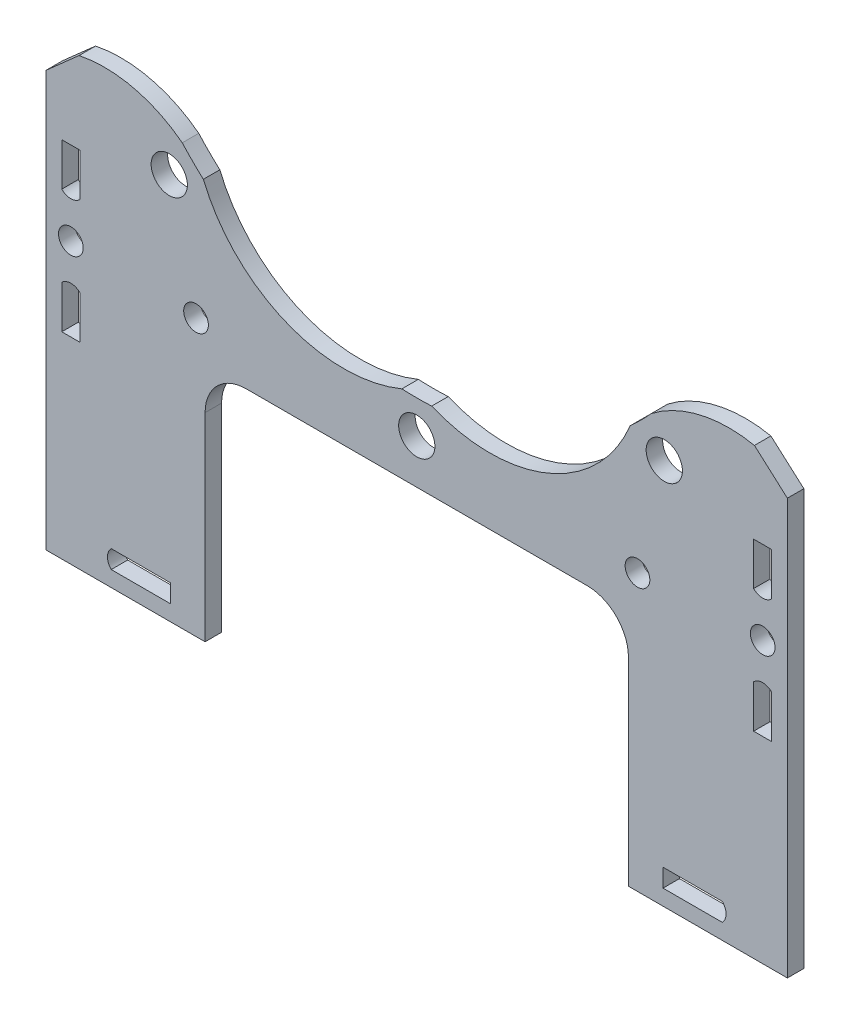
from build123d import *

# Parameters (mm, degrees)
SKETCH_3_R      = 2.2
SKETCH_3_R_2    = 1.5
EXTRUDE_1_DEPTH = 2


with BuildPart() as part:
    # 草图3 → 凸台-拉伸1 (new body)
    with BuildSketch(Plane.XY):
        with BuildLine():
            Line((-41, -23.990216685), (-42, -23.990216685))
            Line((-42, -23.990216685), (-44, -23.990216685))
            Line((-44, -23.990216685), (-45, -23.990216685))
            Line((-45, -23.990216685), (-45, 5.009783315))
            Line((-45, 5.009783315), (-45, 15.009783315))
            Line((-45, 15.009783315), (-45, 26.463053661))
            Line((-45, 26.463053661), (-41, 30.009783315))
            ThreePointArc((-41, 30.009783315), (-34.419700625, 29.918417102), (-28.474223323, 27.097072158))
            ThreePointArc((-28.474223323, 27.097072158), (-27.224142294, 25.7867036), (-25.913822519, 24.536571436))
            ThreePointArc((-25.913822519, 24.536571436), (-15.930575575, 14.55280442), (-1.811764604, 14.552436852))
            ThreePointArc((-1.811764604, 14.552436852), (0, 14.509783471), (1.811764604, 14.552436852))
            ThreePointArc((1.811764604, 14.552436852), (15.930575575, 14.55280442), (25.913822519, 24.536571436))
            ThreePointArc((25.913822519, 24.536571436), (27.224142294, 25.7867036), (28.474223323, 27.097072158))
            ThreePointArc((28.474223323, 27.097072158), (34.419700625, 29.918417102), (41, 30.009783315))
            Line((41, 30.009783315), (45, 26.463053661))
            Line((45, 26.463053661), (45, 15.009783315))
            Line((45, 15.009783315), (45, -23.990216685))
            Line((45, -23.990216685), (41, -23.990216685))
            Line((41, -23.990216685), (25.7, -23.990216685))
            Line((25.7, -23.990216685), (25.7, -19.890216685))
            Line((25.7, -19.890216685), (25.7, -18.890216685))
            Line((25.7, -18.890216685), (25.7, 0.109783315))
            ThreePointArc((25.7, 0.109783315), (24.235533906, 3.645317221), (20.7, 5.109783315))
            Line((20.7, 5.109783315), (-20.7, 5.109783315))
            ThreePointArc((-20.7, 5.109783315), (-24.235533906, 3.645317221), (-25.7, 0.109783315))
            Line((-25.7, 0.109783315), (-25.7, -18.890216685))
            Line((-25.7, -18.890216685), (-25.7, -19.890216685))
            Line((-25.7, -19.890216685), (-25.7, -23.990216685))
            Line((-25.7, -23.990216685), (-41, -23.990216685))
        make_face()
        with Locations((0, 10.509783315)):
            Circle(SKETCH_3_R, mode=Mode.SUBTRACT)
        with Locations((-30.0520382, 22.957745114)):
            Circle(SKETCH_3_R, mode=Mode.SUBTRACT)
        with Locations((30.0520382, 22.957745114)):
            Circle(SKETCH_3_R, mode=Mode.SUBTRACT)
        with Locations((-26.8, 9.509783315)):
            Circle(SKETCH_3_R_2, mode=Mode.SUBTRACT)
        with Locations(Location((26.8, 9.509783315, 0), (0, 0, 180))):
            Circle(SKETCH_3_R_2, mode=Mode.SUBTRACT)
        with Locations((42, 10.009783315)):
            Circle(SKETCH_3_R_2, mode=Mode.SUBTRACT)
        with Locations(Location((-42, 10.009783315, 0), (0, 0, 180))):
            Circle(SKETCH_3_R_2, mode=Mode.SUBTRACT)
        with BuildLine():
            Line((-37.1, -22.090216685), (-29.9, -22.090216685))
            Line((-29.9, -22.090216685), (-29.9, -19.890216685))
            Line((-29.9, -19.890216685), (-37.1, -19.890216685))
            ThreePointArc((-37.1, -19.890216685), (-37.555634919, -20.990216685), (-37.1, -22.090216685))
        make_face(mode=Mode.SUBTRACT)
        with BuildLine():
            Line((29.9, -22.090216685), (29.9, -19.890216685))
            Line((29.9, -19.890216685), (37.1, -19.890216685))
            ThreePointArc((37.1, -19.890216685), (37.555634919, -20.990216685), (37.1, -22.090216685))
            Line((37.1, -22.090216685), (29.9, -22.090216685))
        make_face(mode=Mode.SUBTRACT)
        with BuildLine():
            Line((-43.1, 5.109783315), (-43.1, -0.090216685))
            Line((-43.1, -0.090216685), (-40.9, -0.090216685))
            Line((-40.9, -0.090216685), (-40.9, 5.109783315))
            ThreePointArc((-40.9, 5.109783315), (-42, 5.565418233), (-43.1, 5.109783315))
        make_face(mode=Mode.SUBTRACT)
        with BuildLine():
            Line((-43.1, 20.109783315), (-40.9, 20.109783315))
            Line((-40.9, 20.109783315), (-40.9, 14.909783315))
            ThreePointArc((-40.9, 14.909783315), (-42, 14.454148396), (-43.1, 14.909783315))
            Line((-43.1, 14.909783315), (-43.1, 20.109783315))
        make_face(mode=Mode.SUBTRACT)
        with BuildLine():
            Line((40.9, 20.109783315), (40.9, 14.909783315))
            ThreePointArc((40.9, 14.909783315), (42, 14.454148396), (43.1, 14.909783315))
            Line((43.1, 14.909783315), (43.1, 20.109783315))
            Line((43.1, 20.109783315), (40.9, 20.109783315))
        make_face(mode=Mode.SUBTRACT)
        with BuildLine():
            Line((40.9, 5.109783315), (40.9, -0.090216685))
            Line((40.9, -0.090216685), (43.1, -0.090216685))
            Line((43.1, -0.090216685), (43.1, 5.109783315))
            ThreePointArc((43.1, 5.109783315), (42, 5.565418233), (40.9, 5.109783315))
        make_face(mode=Mode.SUBTRACT)
    extrude(amount=EXTRUDE_1_DEPTH)


solid = part.part
